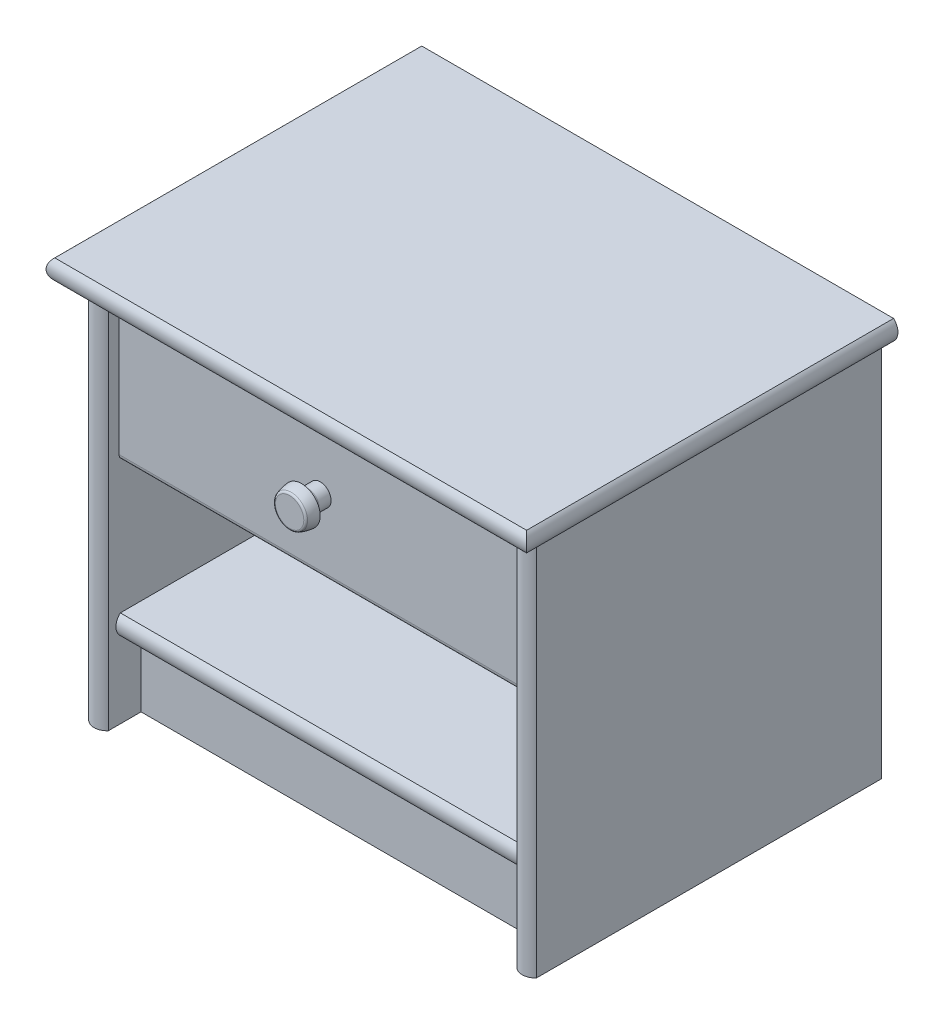
from build123d import *

# Parameters (mm, degrees)
BOSS_EXTRU_1_DEPTH           = 176.25
ENL_V_MAT_EXTRU_1_DEPTH      = 374
ENL_V_MAT_EXTRU_2_REACH      = 440.777
BOSS_EXTRU_2_DEPTH           = 220
ENL_V_MAT_EXTRU_3_DEPTH      = 346.336158692
ENL_V_MAT_EXTRU_3_DEPTH_BACK = 346.336158692


with BuildPart() as part:
    # Esquisse1 → Boss.-Extru.1 (new, symmetric)
    with BuildSketch(Plane(origin=(0, 0, 0), x_dir=(1, 0, 0), z_dir=(0, 1, 0))):
        with BuildLine():
            Line((-205, 158), (205, 158))
            Line((205, 158), (205, -158))
            ThreePointArc((205, -158), (196, -162), (187, -158))
            Line((187, -158), (187, -151))
            Line((187, -151), (-187, -151))
            Line((-187, -151), (-187, -158))
            ThreePointArc((-187, -158), (-196, -162), (-205, -158))
            Line((-205, -158), (-205, 158))
        make_face()
    extrude(amount=BOSS_EXTRU_1_DEPTH, both=True)

    # Esquisse2 → Enlèv. mat.-Extru.1 (cut)
    with BuildSketch(Plane(origin=(-187, 0, 0), x_dir=(0, 0, -1), z_dir=(1, 0, 0))):
        with BuildLine():
            Line((-151, -97.25), (-151, -176.25))
            Line((-151, -176.25), (-128, -176.25))
            Line((-128, -176.25), (-128, -106.25))
            Line((-128, -106.25), (-147, -106.25))
            ThreePointArc((-147, -106.25), (-149.954965027, -102.174428901), (-151, -97.25))
        make_face()
        with BuildLine():
            Line((-151, 40.75), (-151, -97.25))
            ThreePointArc((-151, -97.25), (-149.954965027, -92.325571099), (-147, -88.25))
            Line((-147, -88.25), (140, -88.25))
            Line((140, -88.25), (140, 36.75))
            Line((140, 36.75), (-149, 36.75))
            ThreePointArc((-149, 36.75), (-150.472135955, 38.513932023), (-151, 40.75))
        make_face()
        with BuildLine():
            Line((-148, 176.25), (-151, 176.25))
            Line((-151, 176.25), (-151, 169.25))
            ThreePointArc((-151, 169.25), (-150.218401957, 173.057886553), (-148, 176.25))
        make_face()
    extrude(amount=ENL_V_MAT_EXTRU_1_DEPTH, mode=Mode.SUBTRACT)

    # Enlèv. mat.-Extru.2: up to this face of the body (flat: up to its plane)
    enl_v_mat_extru_2_end = Plane(part.part.faces().sort_by_distance((0, 36.75, 4.5))[0])
    # Esquisse3 → Enlèv. mat.-Extru.2 (cut, up to the picked face)
    with BuildSketch(Plane(origin=(0, 176.25, 0), x_dir=(1, 0, 0), z_dir=(0, 1, 0)), mode=Mode.PRIVATE) as enl_v_mat_extru_2_sk1:
        with BuildLine():
            Line((-187, -151), (-187, -142))
            ThreePointArc((-187, -142), (-186.230249471, -146.74341649), (-184, -151))
            Line((-184, -151), (-187, -151))
        make_face()
    enl_v_mat_extru_2_tool1 = split(extrude(enl_v_mat_extru_2_sk1.sketch, amount=-ENL_V_MAT_EXTRU_2_REACH, mode=Mode.PRIVATE), bisect_by=enl_v_mat_extru_2_end, keep=Keep.BOTH, mode=Mode.PRIVATE)
    # Esquisse3 → Enlèv. mat.-Extru.2 (cut, up to the picked face)
    with BuildSketch(Plane(origin=(0, 176.25, 0), x_dir=(1, 0, 0), z_dir=(0, 1, 0)), mode=Mode.PRIVATE) as enl_v_mat_extru_2_sk2:
        with BuildLine():
            Line((184, -151), (187, -151))
            Line((187, -151), (187, -142))
            ThreePointArc((187, -142), (186.230249471, -146.74341649), (184, -151))
        make_face()
    enl_v_mat_extru_2_tool2 = split(extrude(enl_v_mat_extru_2_sk2.sketch, amount=-ENL_V_MAT_EXTRU_2_REACH, mode=Mode.PRIVATE), bisect_by=enl_v_mat_extru_2_end, keep=Keep.BOTH, mode=Mode.PRIVATE)
    add(enl_v_mat_extru_2_tool1.solids().sort_by(Axis((-186.117852, 176.25, 148.797484), (0, -1, 0)))[0], mode=Mode.SUBTRACT)
    add(enl_v_mat_extru_2_tool2.solids().sort_by(Axis((186.117852, 176.25, 148.797484), (0, -1, 0)))[0], mode=Mode.SUBTRACT)

    # Esquisse4 → Boss.-Extru.2 (add, symmetric)
    with BuildSketch(Plane(origin=(0, 0, 0), x_dir=(0, 0, -1), z_dir=(1, 0, 0))):
        with BuildLine():
            Line((158, 176.25), (-178, 176.25))
            ThreePointArc((-178, 176.25), (-182, 185.25), (-178, 194.25))
            Line((-178, 194.25), (158, 194.25))
            Line((158, 194.25), (158, 176.25))
        make_face()
    extrude(amount=BOSS_EXTRU_2_DEPTH, both=True)

    # Esquisse5 → Enlèv. mat.-Extru.3 (cut, two sides: drawn at the far end of the back side and taken through both)
    with BuildSketch(Plane.XY.offset(-ENL_V_MAT_EXTRU_3_DEPTH_BACK)):
        with BuildLine():
            Line((220, 194.25), (216, 194.25))
            ThreePointArc((216, 194.25), (218.954965027, 190.174428901), (220, 185.25))
            Line((220, 185.25), (220, 194.25))
        make_face()
        with BuildLine():
            ThreePointArc((-220, 185.25), (-218.954965027, 190.174428901), (-216, 194.25))
            Line((-216, 194.25), (-220, 194.25))
            Line((-220, 194.25), (-220, 185.25))
        make_face()
        with BuildLine():
            ThreePointArc((-216, 176.25), (-218.954965027, 180.325571099), (-220, 185.25))
            Line((-220, 185.25), (-220, 176.25))
            Line((-220, 176.25), (-216, 176.25))
        make_face()
        with BuildLine():
            Line((220, 176.25), (220, 185.25))
            ThreePointArc((220, 185.25), (218.954965027, 180.325571099), (216, 176.25))
            Line((216, 176.25), (220, 176.25))
        make_face()
    extrude(amount=ENL_V_MAT_EXTRU_3_DEPTH + ENL_V_MAT_EXTRU_3_DEPTH_BACK, mode=Mode.SUBTRACT)

    # Esquisse6 → Révolution1 (revolve)
    with BuildSketch(Plane(origin=(0, 0, 0), x_dir=(0, 0, -1), z_dir=(1, 0, 0)), mode=Mode.PRIVATE) as r_volution1_sk:
        with BuildLine():
            Line((-151, 111.25), (-162, 111.25))
            ThreePointArc((-162, 111.25), (-166.242640687, 113.007359313), (-168, 117.25))
            Line((-168, 117.25), (-168, 118.25))
            ThreePointArc((-168, 118.25), (-172.862133877, 117.576087333), (-177.588231263, 116.25))
            ThreePointArc((-177.588231263, 116.25), (-178.611504042, 115.474039518), (-179, 114.25))
            Line((-179, 114.25), (-179, 101.25))
            Line((-179, 101.25), (-151, 101.25))
            Line((-151, 101.25), (-151, 111.25))
        make_face()
    revolve(r_volution1_sk.sketch.rotate(Axis((0, 101.25, 201.29718837), (0, 0, -1)), 90), axis=Axis((0, 101.25, 201.29718837), (0, 0, -1)))


solid = part.part
